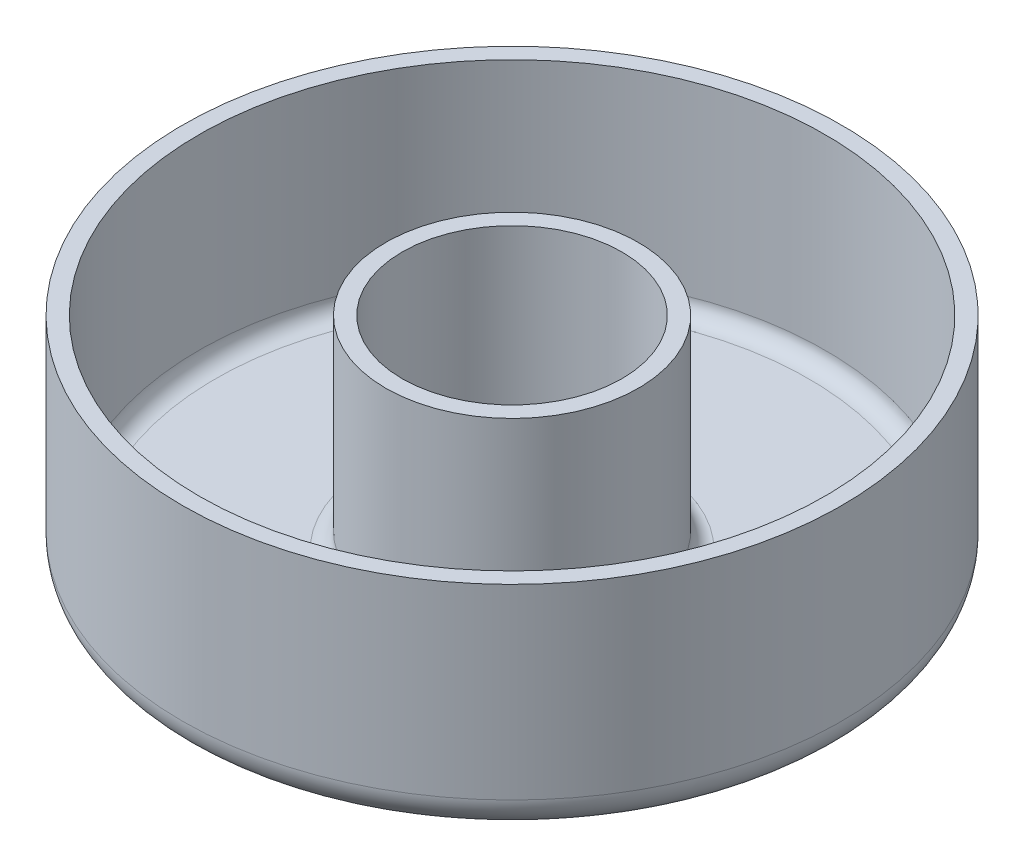
from build123d import *


with BuildPart() as part:
    # Sketch2 → Revolve1 (revolve)
    with BuildSketch(Plane(origin=(0, 0, 0), x_dir=(0, 0, -1), z_dir=(1, 0, 0))):
        with BuildLine():
            Line((-5, 4.25), (-5, -4.25))
            ThreePointArc((-5, -4.25), (-5.439339828, -5.310660172), (-6.5, -5.75))
            Line((-6.5, -5.75), (-13.5, -5.75))
            ThreePointArc((-13.5, -5.75), (-14.560660172, -5.310660172), (-15, -4.25))
            Line((-15, -4.25), (-15, 4.25))
            Line((-15, 4.25), (-14.25, 4.25))
            Line((-14.25, 4.25), (-14.25, -4.25))
            ThreePointArc((-14.25, -4.25), (-14.030330086, -4.780330086), (-13.5, -5))
            Line((-13.5, -5), (-6.5, -5))
            ThreePointArc((-6.5, -5), (-5.969669914, -4.780330086), (-5.75, -4.25))
            Line((-5.75, -4.25), (-5.75, 4.25))
            Line((-5.75, 4.25), (-5, 4.25))
        make_face()
    revolve(axis=Axis((0, 14.872392435, 0), (0, -1, 0)))


solid = part.part
